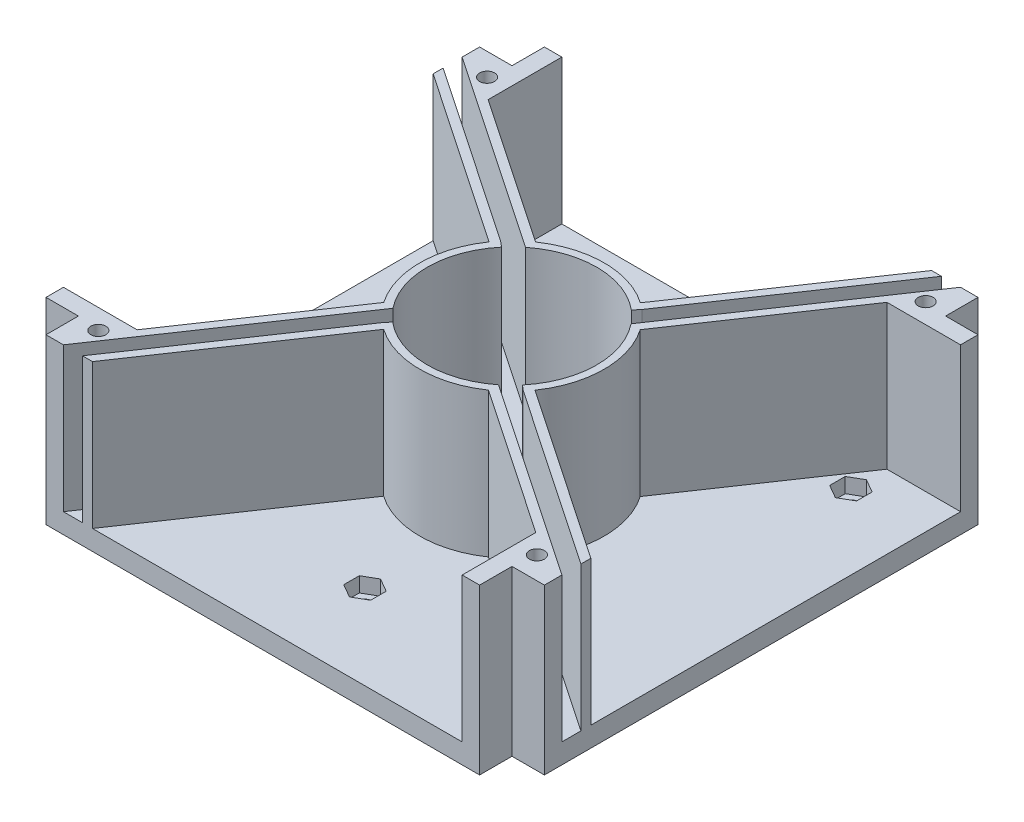
from build123d import *

# Parameters (mm, degrees)
SKETCH1_W           = 100
SKETCH1_H           = 100
BOSS_EXTRUDE1_DEPTH = 4
SKETCH2_R           = 4.7625
CUT_EXTRUDE1_DEPTH  = 71.823724839
SKETCH3_W           = 8.5
SKETCH3_H           = 8.5
CUT_EXTRUDE2_DEPTH  = 71.823724839
BOSS_EXTRUDE3_DEPTH = 29
BOSS_EXTRUDE4_DEPTH = 29
CUT_EXTRUDE4_DEPTH  = 77.426435217
BOSS_EXTRUDE5_DEPTH = 29
BOSS_EXTRUDE6_DEPTH = 29
SKETCH12_R          = 1.5
CUT_EXTRUDE5_DEPTH  = 79.0320447
CUT_EXTRUDE6_DEPTH  = 3
SKETCH15_R          = 1.5
CUT_EXTRUDE7_DEPTH  = 10
BOSS_EXTRUDE7_DEPTH = 33
SCALE1_SCALE        = 0.95


with BuildPart() as part:
    # Sketch1 → Boss-Extrude1 (new body)
    with BuildSketch(Plane(origin=(0, 0, 0), x_dir=(1, 0, 0), z_dir=(0, 1, 0))):
        Rectangle(SKETCH1_W, SKETCH1_H)
    extrude(amount=BOSS_EXTRUDE1_DEPTH)

    # Sketch2 → Cut-Extrude1 (cut, through all)
    with BuildSketch(Plane(origin=(0, 4, 0), x_dir=(1, 0, 0), z_dir=(0, 1, 0))):
        with Locations(Location((0, 0, 0), (0, 0, 270))):
            Circle(SKETCH2_R)
    extrude(amount=-CUT_EXTRUDE1_DEPTH, mode=Mode.SUBTRACT)

    # Sketch3 → Cut-Extrude2 (cut, through all)
    with BuildSketch(Plane(origin=(0, 4, 0), x_dir=(1, 0, 0), z_dir=(0, 1, 0))):
        with Locations((-45.75, 45.75)):
            Rectangle(SKETCH3_W, SKETCH3_H)
        with Locations((45.75, 45.75)):
            Rectangle(SKETCH3_W, SKETCH3_H)
        with Locations((45.75, -45.75)):
            Rectangle(SKETCH3_W, SKETCH3_H)
        with Locations((-45.75, -45.75)):
            Rectangle(SKETCH3_W, SKETCH3_H)
    extrude(amount=-CUT_EXTRUDE2_DEPTH, mode=Mode.SUBTRACT)

    # Sketch4 → Boss-Extrude3 (add)
    with BuildSketch(Plane(origin=(0, 4, 0), x_dir=(1, 0, 0), z_dir=(0, 1, 0))):
        with BuildLine():
            Line((-10.927389365, -13.022755533), (-11.891570779, -14.171822198))
            ThreePointArc((-11.891570779, -14.171822198), (0, -18.5), (11.891570779, -14.171822198))
            Line((11.891570779, -14.171822198), (10.927389365, -13.022755533))
            ThreePointArc((10.927389365, -13.022755533), (0, -17), (-10.927389365, -13.022755533))
        make_face()
        with BuildLine():
            Line((-13.022755533, -10.927389365), (-14.171822198, -11.891570779))
            ThreePointArc((-14.171822198, -11.891570779), (-18.5, 0), (-14.171822198, 11.891570779))
            Line((-14.171822198, 11.891570779), (-13.022755533, 10.927389365))
            ThreePointArc((-13.022755533, 10.927389365), (-17, 0), (-13.022755533, -10.927389365))
        make_face()
        with BuildLine():
            Line((-10.927389365, 13.022755533), (-11.891570779, 14.171822198))
            ThreePointArc((-11.891570779, 14.171822198), (0, 18.5), (11.891570779, 14.171822198))
            Line((11.891570779, 14.171822198), (10.927389365, 13.022755533))
            ThreePointArc((10.927389365, 13.022755533), (0, 17), (-10.927389365, 13.022755533))
        make_face()
        with BuildLine():
            Line((13.022755533, 10.927389365), (14.171822198, 11.891570779))
            ThreePointArc((14.171822198, 11.891570779), (18.5, 0), (14.171822198, -11.891570779))
            Line((14.171822198, -11.891570779), (13.022755533, -10.927389365))
            ThreePointArc((13.022755533, -10.927389365), (17, 0), (13.022755533, 10.927389365))
        make_face()
    extrude(amount=BOSS_EXTRUDE3_DEPTH)

    # Sketch7 → Boss-Extrude4 (add)
    with BuildSketch(Plane(origin=(0, 4, 0), x_dir=(1, 0, 0), z_dir=(0, 1, 0))):
        Polygon((-41.5, -41.5), (-41.5, -50), (-40, -50), (-40, -40), (-50, -40), (-50, -41.5), align=None)
        Polygon((40, -50), (40, -40), (50, -40), (50, -41.5), (41.5, -41.5), (41.5, -50), align=None)
        Polygon((50, 41.5), (50, 40), (40, 40), (40, 50), (41.5, 50), (41.5, 41.5), align=None)
        Polygon((-50, 41.5), (-50, 40), (-40, 40), (-40, 50), (-41.5, 50), (-41.5, 41.5), align=None)
    extrude(amount=BOSS_EXTRUDE4_DEPTH)

    # Sketch8 → Cut-Extrude4 (cut, through all)
    with BuildSketch(Plane(origin=(0, 4, 0), x_dir=(1, 0, 0), z_dir=(0, 1, 0))):
        Polygon((-14.171822198, -11.891570779), (-40, -50), (-36.17429682, -50), (-11.891570779, -14.171822198), (-9.867198001, -11.184942236), (-12.488706492, -9.408201793), align=None)
        Polygon((-11.891570779, 14.171822198), (-50, 40), (-50, 36.17429682), (-14.171822198, 11.891570779), (-11.184942236, 9.867198001), (-9.408201793, 12.488706492), align=None)
        Polygon((14.171822198, 11.891570779), (40, 50), (36.17429682, 50), (11.891570779, 14.171822198), (9.867198001, 11.184942236), (12.488706492, 9.408201793), align=None)
        Polygon((11.891570779, -14.171822198), (50, -40), (50, -36.17429682), (14.171822198, -11.891570779), (11.184942236, -9.867198001), (9.408201793, -12.488706492), align=None)
    extrude(amount=CUT_EXTRUDE4_DEPTH, mode=Mode.SUBTRACT)

    # Sketch9 → Boss-Extrude5 (add)
    with BuildSketch(Plane(origin=(0, 4, 0), x_dir=(1, 0, 0), z_dir=(0, 1, 0))):
        Polygon((-11.891570779, -14.171822198), (-36.17429682, -50), (-34.17429682, -50), (-10.52109933, -15.100666052), align=None)
        Polygon((-14.171822198, -11.891570779), (-40, -50), (-40, -47.049081084), (-14.981255079, -10.134937263), (-13.610783629, -11.063781117), align=None)
        Polygon((-50, 34.17429682), (-15.100666052, 10.52109933), (-14.171822198, 11.891570779), (-50, 36.17429682), align=None)
        Polygon((-11.891570779, 14.171822198), (-50, 40), (-47.049081084, 40), (-10.134937263, 14.981255079), (-11.063781117, 13.610783629), align=None)
        Polygon((34.17429682, 50), (10.52109933, 15.100666052), (11.891570779, 14.171822198), (36.17429682, 50), align=None)
        Polygon((14.171822198, 11.891570779), (40, 50), (40, 47.049081084), (14.981255079, 10.134937263), (13.610783629, 11.063781117), align=None)
        Polygon((50, -34.17429682), (15.100666052, -10.52109933), (14.171822198, -11.891570779), (50, -36.17429682), align=None)
        Polygon((11.891570779, -14.171822198), (50, -40), (47.049081084, -40), (10.134937263, -14.981255079), (11.063781117, -13.610783629), align=None)
    extrude(amount=BOSS_EXTRUDE5_DEPTH)

    # Sketch11 → Boss-Extrude6 (add)
    with BuildSketch(Plane(origin=(0, 4, 0), x_dir=(1, 0, 0), z_dir=(0, 1, 0))):
        Polygon((-40, -40), (-35.222450169, -40), (-40, -47.049081084), align=None)
        Polygon((-40, 40), (-40, 35.222450169), (-47.049081084, 40), align=None)
        Polygon((40, 40), (35.222450169, 40), (40, 47.049081084), align=None)
        Polygon((40, -40), (40, -35.222450169), (47.049081084, -40), align=None)
    extrude(amount=BOSS_EXTRUDE6_DEPTH)

    # Sketch12 → Cut-Extrude5 (cut, through all)
    with BuildSketch(Plane(origin=(0, 0, 0), x_dir=(-1, 0, 0), z_dir=(0, -1, 0))):
        with Locations(Location((-3.5, 33, 0), (0, 0, 90))):
            Circle(SKETCH12_R)
        with Locations(Location((-3.5, -33, 0), (0, 0, 90))):
            Circle(SKETCH12_R)
        with Locations(Location((-35, 33, 0), (0, 0, 90))):
            Circle(SKETCH12_R)
        with Locations(Location((-28, -33, 0), (0, 0, 90))):
            Circle(SKETCH12_R)
    extrude(amount=-CUT_EXTRUDE5_DEPTH, mode=Mode.SUBTRACT)

    # Sketch14 → Cut-Extrude6 (cut)
    with BuildSketch(Plane(origin=(0, 4, 0), x_dir=(1, 0, 0), z_dir=(0, 1, 0))):
        Polygon((28, -29.882308546), (25.3, -31.441154273), (25.3, -34.558845727), (28, -36.117691454), (30.7, -34.558845727), (30.7, -31.441154273), align=None)
        Polygon((3.5, -29.882308546), (0.8, -31.441154273), (0.8, -34.558845727), (3.5, -36.117691454), (6.2, -34.558845727), (6.2, -31.441154273), align=None)
        Polygon((3.5, 36.117691454), (0.8, 34.558845727), (0.8, 31.441154273), (3.5, 29.882308546), (6.2, 31.441154273), (6.2, 34.558845727), align=None)
        Polygon((35, 36.117691454), (32.3, 34.558845727), (32.3, 31.441154273), (35, 29.882308546), (37.7, 31.441154273), (37.7, 34.558845727), align=None)
    extrude(amount=-CUT_EXTRUDE6_DEPTH, mode=Mode.SUBTRACT)

    # Sketch15 → Cut-Extrude7 (cut)
    with BuildSketch(Plane(origin=(0, 33, 0), x_dir=(1, 0, 0), z_dir=(0, 1, 0))):
        with Locations(Location((44, -39, 0), (0, 0, 270))):
            Circle(SKETCH15_R)
        with Locations(Location((-39, -44, 0), (0, 0, 270))):
            Circle(SKETCH15_R)
        with Locations(Location((-44, 39, 0), (0, 0, 270))):
            Circle(SKETCH15_R)
        with Locations(Location((39, 44, 0), (0, 0, 270))):
            Circle(SKETCH15_R)
    extrude(amount=-CUT_EXTRUDE7_DEPTH, mode=Mode.SUBTRACT)

    # Sketch16 → Boss-Extrude7 (add)
    with BuildSketch(Plane.XZ):
        Polygon((-50, 41.5), (-50, 43.5), (-43.5, 43.5), (-43.5, 50), (-41.5, 50), (-41.5, 41.5), align=None)
        Polygon((50, 41.5), (41.5, 41.5), (41.5, 50), (43.5, 50), (43.5, 43.5), (50, 43.5), align=None)
        Polygon((50, -41.5), (50, -43.5), (43.5, -43.5), (43.5, -50), (41.5, -50), (41.5, -41.5), align=None)
        Polygon((-50, -41.5), (-41.5, -41.5), (-41.5, -50), (-43.5, -50), (-43.5, -43.5), (-50, -43.5), align=None)
    extrude(amount=-BOSS_EXTRUDE7_DEPTH)


with BuildPart() as part_1:
    # Scale1: scaled about (-0.08501153, 9.094594804, 0)
    add(part.part.scale(SCALE1_SCALE).moved(Location((-0.004250577, 0.45472974, 0))))


solid = part_1.part
